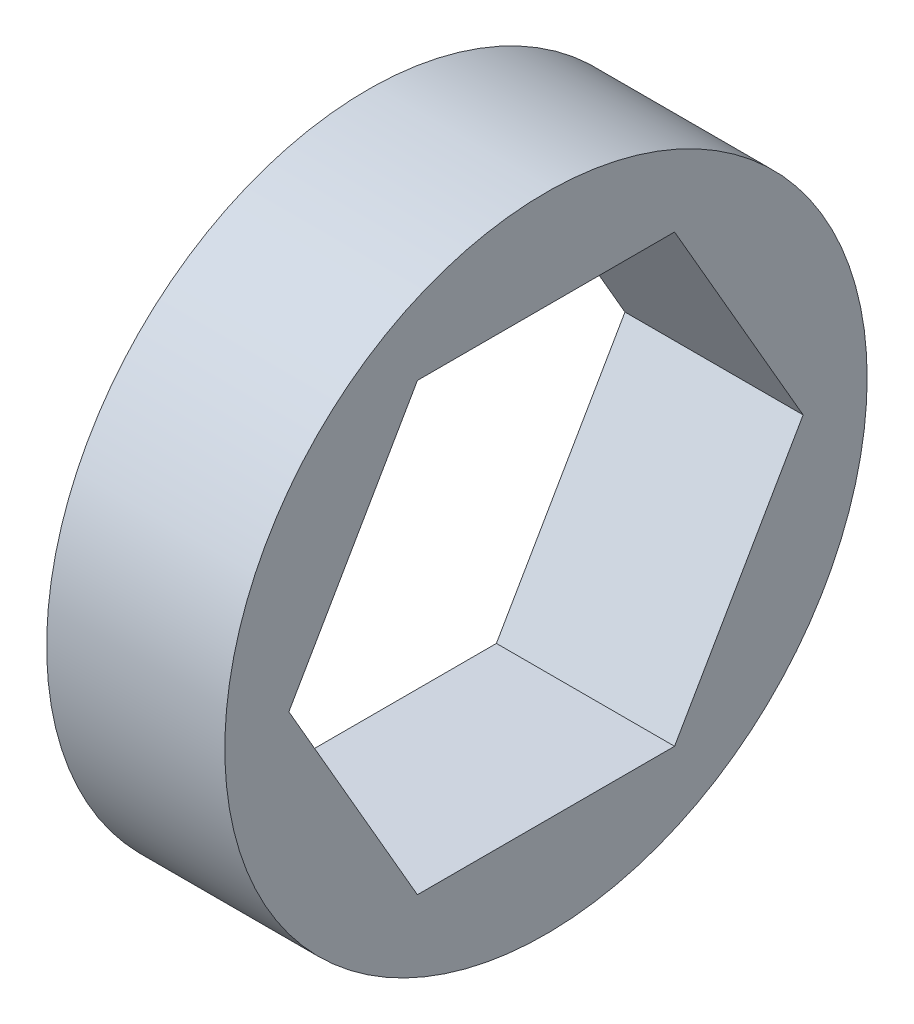
from build123d import *

# Parameters (mm, degrees)
SKETCH1_R           = 9.525
BOSS_EXTRUDE1_DEPTH = 5.2832


with BuildPart() as part:
    # Sketch1 → Boss-Extrude1 (new body)
    with BuildSketch(Plane(origin=(0, 0, 0), x_dir=(0, 0, -1), z_dir=(1, 0, 0))):
        Circle(SKETCH1_R)
        Polygon((7.625642355, 0), (3.812821178, 6.604), (-3.812821178, 6.604), (-7.625642355, 0), (-3.812821178, -6.604), (3.812821178, -6.604), align=None, mode=Mode.SUBTRACT)
    extrude(amount=BOSS_EXTRUDE1_DEPTH)


solid = part.part
